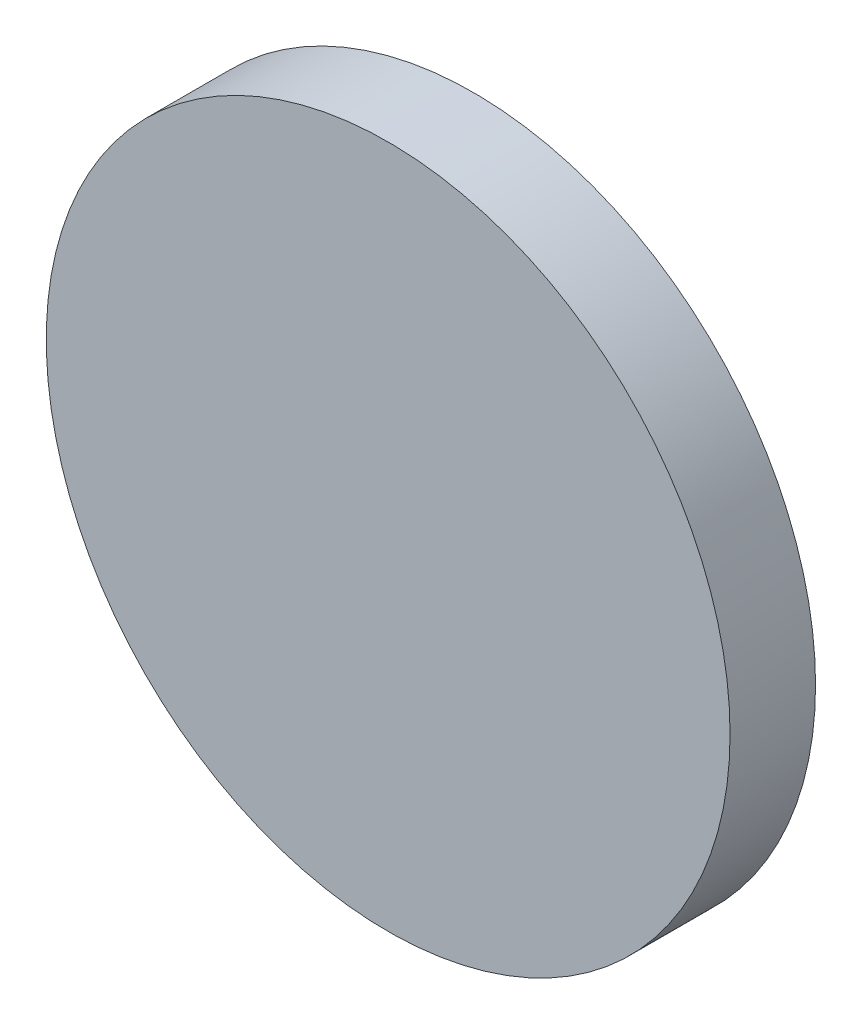
from build123d import *

# Parameters (mm, degrees)
SKETCH_1_R      = 10
EXTRUDE_3_DEPTH = 2.5
SKETCH_5_R      = 4.5
EXTRUDE_4_DEPTH = 2


with BuildPart() as part:
    # 草图1 → 凸台-拉伸3 (new body)
    with BuildSketch(Plane.XY):
        Circle(SKETCH_1_R)
    extrude(amount=EXTRUDE_3_DEPTH)

    # 草图5 → 凸台-拉伸4 (add)
    with BuildSketch(Plane(origin=(0, 0, 0), x_dir=(-1, 0, 0), z_dir=(0, 0, -1))):
        Circle(SKETCH_5_R)
    extrude(amount=EXTRUDE_4_DEPTH)


solid = part.part
